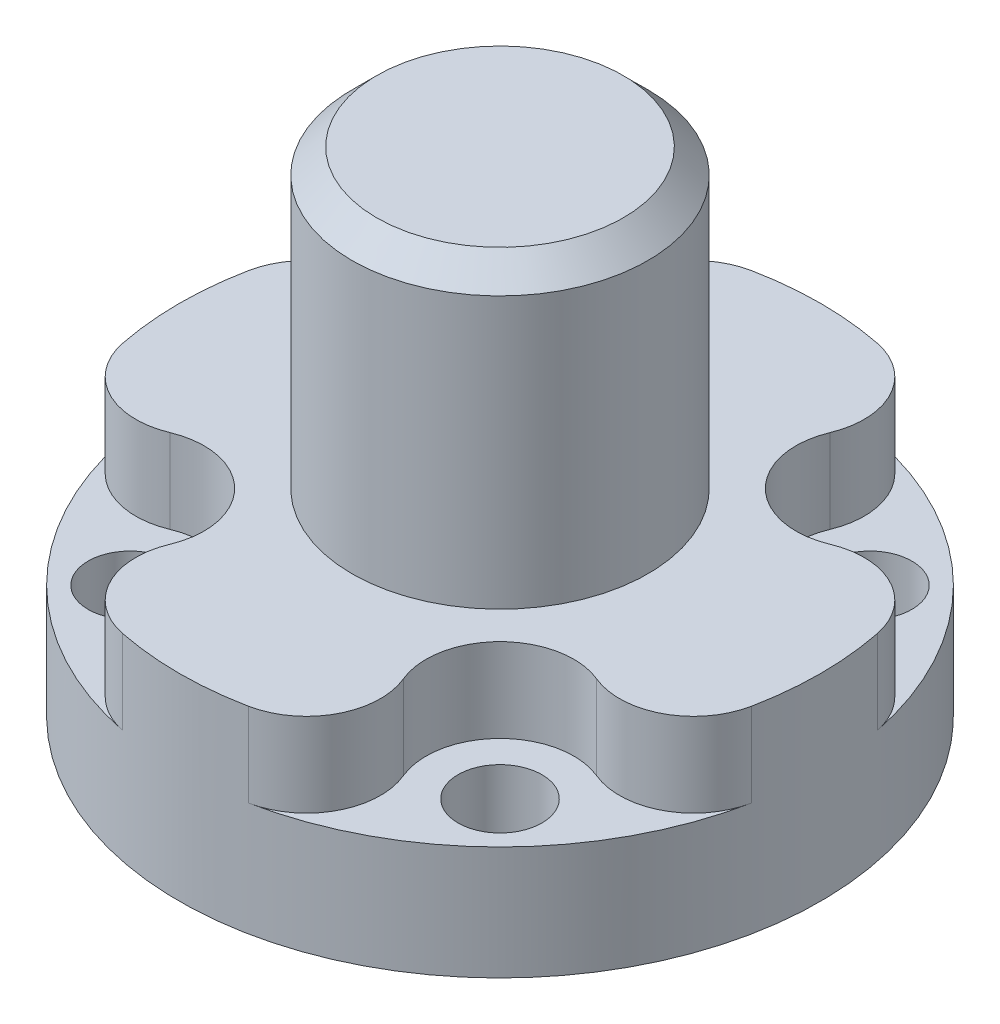
from build123d import *

# Parameters (mm, degrees)
SKETCH1_R                                            = 6
BOSS_EXTRUDE1_DEPTH                                  = 20
SKETCH3_R                                            = 13
BOSS_EXTRUDE2_DEPTH                                  = 8
CBORE_FOR_M3_HEXAGON_SOCKET_HEAD_CAP_SCR_D           = 3.4
CBORE_FOR_M3_HEXAGON_SOCKET_HEAD_CAP_SCR_CBORE_D     = 6
CBORE_FOR_M3_HEXAGON_SOCKET_HEAD_CAP_SCR_CBORE_DEPTH = 3.4
FILLET1_R                                            = 3
CHAMFER1_SIZE                                        = 1
SKETCH7_R                                            = 3
BOSS_EXTRUDE3_DEPTH                                  = 5
CHAMFER2_SIZE                                        = 1


with BuildPart() as part:
    # Sketch1 → Boss-Extrude1 (new body)
    with BuildSketch(Plane(origin=(0, 0, 0), x_dir=(1, 0, 0), z_dir=(0, 1, 0))):
        with Locations(Location((0, 0, 0), (0, 0, 270))):
            Circle(SKETCH1_R)
    extrude(amount=BOSS_EXTRUDE1_DEPTH)

    # Sketch3 → Boss-Extrude2 (add)
    with BuildSketch(Plane.XZ):
        with Locations(Location((0, 0, 0), (0, 0, 270))):
            Circle(SKETCH3_R)
    extrude(amount=-BOSS_EXTRUDE2_DEPTH)

    # CBORE for M3 Hexagon socket head cap screws1 (through all)
    with Locations(Plane(origin=(0, 8, 0), x_dir=(1, 0, 0), z_dir=(0, 1, 0))):
        with Locations((-7.5, 7.5), (-7.5, -7.5), (7.5, -7.5), (7.5, 7.5)):
            CounterBoreHole(CBORE_FOR_M3_HEXAGON_SOCKET_HEAD_CAP_SCR_D / 2, CBORE_FOR_M3_HEXAGON_SOCKET_HEAD_CAP_SCR_CBORE_D / 2, CBORE_FOR_M3_HEXAGON_SOCKET_HEAD_CAP_SCR_CBORE_DEPTH)

    # Fillet1
    fillet1_edges = [part.edges().sort_by_distance(p)[0] for p in [
        (10.495089529, 6.3, -7.671577138),
        (7.671577138, 6.3, -10.495089529),
        (7.671577138, 6.3, 10.495089529),
        (10.495089529, 6.3, 7.671577138),
        (-7.671577138, 6.3, 10.495089529),
        (-10.495089529, 6.3, 7.671577138),
        (-7.671577138, 6.3, -10.495089529),
        (-10.495089529, 6.3, -7.671577138),
    ]]
    fillet(fillet1_edges, radius=FILLET1_R)

    # Chamfer1
    chamfer1_edges = [part.edges().sort_by_distance(p)[0] for p in [
        (0, 20, -6),
    ]]
    chamfer(chamfer1_edges, length=CHAMFER1_SIZE)

    # Sketch7 → Boss-Extrude3 (add)
    with BuildSketch(Plane.XZ):
        with Locations(Location((0, 0, 0), (0, 0, 90))):
            Circle(SKETCH7_R)
    extrude(amount=BOSS_EXTRUDE3_DEPTH)

    # Chamfer2
    chamfer2_edges = [part.edges().sort_by_distance(p)[0] for p in [
        (0, -5, -3),
    ]]
    chamfer(chamfer2_edges, length=CHAMFER2_SIZE)


solid = part.part
